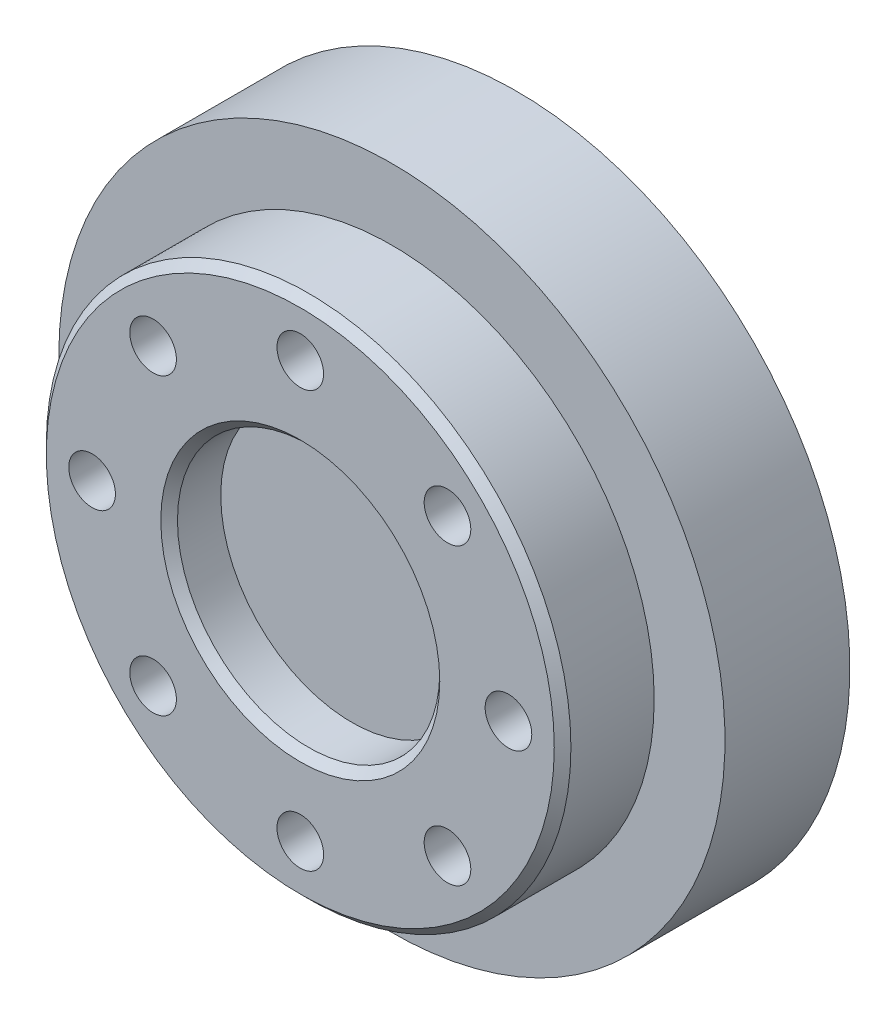
from build123d import *

# Parameters (mm, degrees)
SKETCH1_R           = 31.5
BOSS_EXTRUDE1_DEPTH = 11
SKETCH2_R           = 2.8
CUT_EXTRUDE5_DEPTH  = 9
SKETCH4_R           = 15.75
CUT_EXTRUDE6_DEPTH  = 6.2
CHAMFER1_SIZE       = 1
CHAMFER2_SIZE       = 1
SKETCH5_R           = 40
BOSS_EXTRUDE3_DEPTH = 15


with BuildPart() as part:
    # Sketch1 → Boss-Extrude1 (new body)
    with BuildSketch(Plane.XY):
        Circle(SKETCH1_R)
    extrude(amount=-BOSS_EXTRUDE1_DEPTH)

    # Sketch2 → Cut-Extrude5 (cut)
    with BuildSketch(Plane.XY):
        with Locations((0, 25)):
            Circle(SKETCH2_R)
        with Locations((17.67766953, 17.67766953)):
            Circle(SKETCH2_R)
        with Locations((25, 0)):
            Circle(SKETCH2_R)
        with Locations((17.67766953, -17.67766953)):
            Circle(SKETCH2_R)
        with Locations((0, -25)):
            Circle(SKETCH2_R)
        with Locations((-17.67766953, -17.67766953)):
            Circle(SKETCH2_R)
        with Locations((-25, 0)):
            Circle(SKETCH2_R)
        with Locations((-17.67766953, 17.67766953)):
            Circle(SKETCH2_R)
    extrude(amount=-CUT_EXTRUDE5_DEPTH, mode=Mode.SUBTRACT)

    # Sketch4 → Cut-Extrude6 (cut)
    with BuildSketch(Plane.XY):
        Circle(SKETCH4_R)
    extrude(amount=-CUT_EXTRUDE6_DEPTH, mode=Mode.SUBTRACT)

    # Chamfer1
    chamfer1_edges = [part.edges().sort_by_distance(p)[0] for p in [
        (-31.5, 0, 0),
    ]]
    chamfer(chamfer1_edges, length=CHAMFER1_SIZE)

    # Chamfer2
    chamfer2_edges = [part.edges().sort_by_distance(p)[0] for p in [
        (-15.75, 0, 0),
    ]]
    chamfer(chamfer2_edges, length=CHAMFER2_SIZE)

    # Sketch5 → Boss-Extrude3 (add)
    with BuildSketch(Plane(origin=(0, 0, -11), x_dir=(-1, 0, 0), z_dir=(0, 0, -1))):
        Circle(SKETCH5_R)
    extrude(amount=BOSS_EXTRUDE3_DEPTH)


solid = part.part
